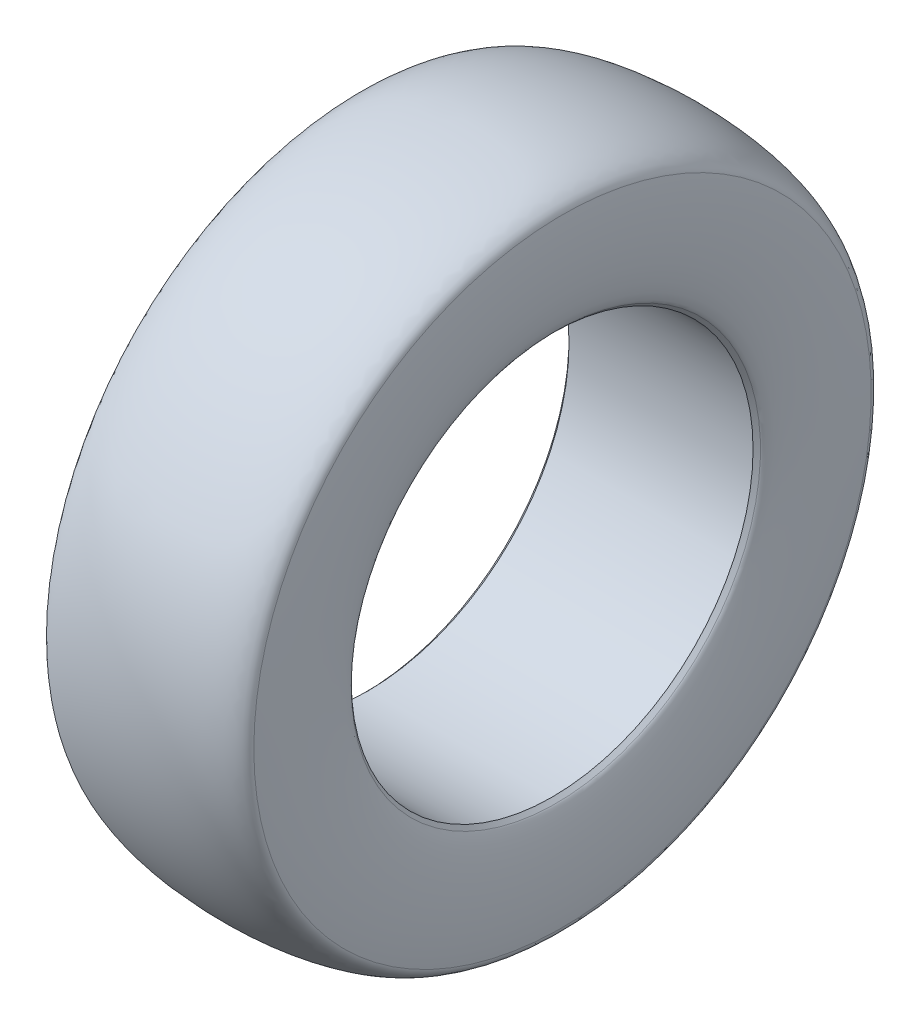
from build123d import *


with BuildPart() as part:
    # Sketch1 → Revolve2 (revolve)
    with BuildSketch(Plane.XY, mode=Mode.PRIVATE) as revolve2_sk:
        with BuildLine():
            Line((-111.669743879, 243.84), (111.669743879, 243.84))
            Line((111.669743879, 243.84), (116.159871939, 248.330128061))
            add(Edge.make_bspline(
                [(116.159871939, 248.330128061), (137.810721683, 269.980977804), (124.216998202, 374.580726901)],
                knots=[3.304797887, 3.304797887, 3.304797887, 5.380517095, 5.380517095, 5.380517095], degree=2, weights=[1, 0.508064983, 1]))
            add(Edge.make_bspline(
                [(124.216998202, 374.580726901), (120.081783695, 406.4), (0, 406.4), (-120.081783695, 406.4), (-124.216998202, 374.580726901)],
                knots=[3.176036115, 3.176036115, 3.176036115, 4.71238898, 4.71238898, 6.248741846, 6.248741846, 6.248741846], degree=2, weights=[1, 0.719178925, 1, 0.719178925, 1]))
            add(Edge.make_bspline(
                [(-124.216998202, 374.580726901), (-137.810721683, 269.980977804), (-116.159871939, 248.330128061)],
                knots=[0.902668212, 0.902668212, 0.902668212, 2.97838742, 2.97838742, 2.97838742], degree=2, weights=[1, 0.508064983, 1]))
            Line((-116.159871939, 248.330128061), (-111.669743879, 243.84))
        make_face()
    revolve(revolve2_sk.sketch.rotate(Axis((-1000, 0, 0), (1, 0, 0)), 90), axis=Axis((-1000, 0, 0), (1, 0, 0)))


solid = part.part
